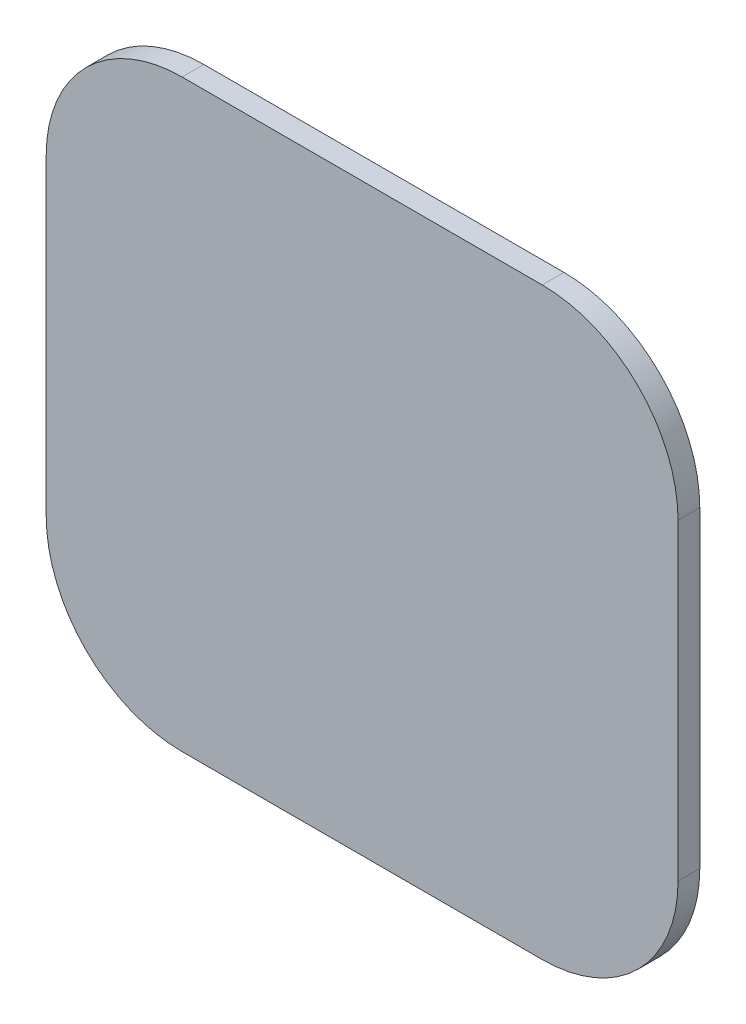
from build123d import *

# Parameters (mm, degrees)
RESSALTO_EXTRUS_O1_DEPTH = 1.6


with BuildPart() as part:
    # Esboço1 → Ressalto-extrusão1 (new body)
    with BuildSketch(Plane.XY):
        with BuildLine():
            Line((-10, 0), (-36.5, 0))
            ThreePointArc((-36.5, 0), (-43.571067812, 2.928932188), (-46.5, 10))
            Line((-46.5, 10), (-46.5, 33))
            ThreePointArc((-46.5, 33), (-43.571067812, 40.071067812), (-36.5, 43))
            Line((-36.5, 43), (-10, 43))
            ThreePointArc((-10, 43), (-2.928932188, 40.071067812), (0, 33))
            Line((0, 33), (0, 10))
            ThreePointArc((0, 10), (-2.928932188, 2.928932188), (-10, 0))
        make_face()
    extrude(amount=RESSALTO_EXTRUS_O1_DEPTH)


solid = part.part
